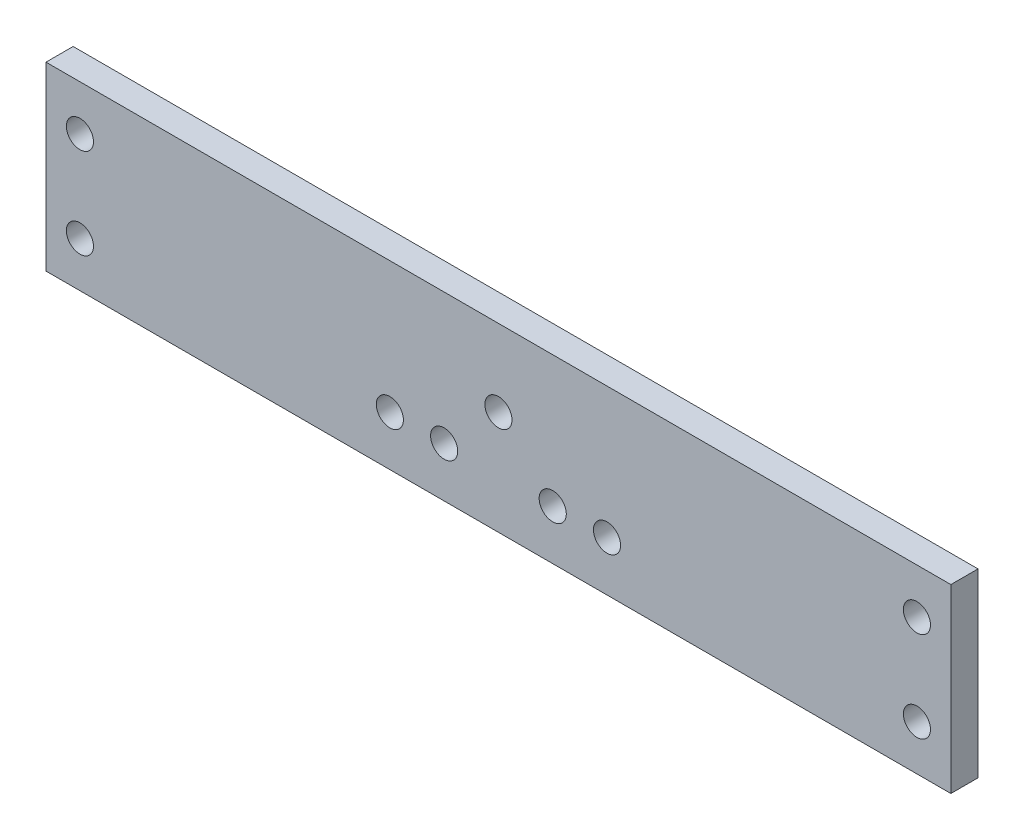
from build123d import *

# Parameters (mm, degrees)
SKETCH_1_R      = 1.5
EXTRUDE_1_DEPTH = 3


with BuildPart() as part:
    # 草圖1 → 填料-伸長1 (new body)
    with BuildSketch(Plane.XY):
        Polygon((50, 10), (0, 10), (-50, 10), (-50, -10), (0, -10), (50, -10), align=None)
        with Locations((-46.25, -5)):
            Circle(SKETCH_1_R, mode=Mode.SUBTRACT)
        with Locations((-12, -4.5)):
            Circle(SKETCH_1_R, mode=Mode.SUBTRACT)
        with BuildLine():
            ThreePointArc((-7.5, -4.5), (-6, -3), (-4.5, -4.5))
            ThreePointArc((-4.5, -4.5), (-6, -6), (-7.5, -4.5))
        make_face(mode=Mode.SUBTRACT)
        with BuildLine():
            ThreePointArc((7.5, -4.5), (6, -6), (4.5, -4.5))
            ThreePointArc((4.5, -4.5), (6, -3), (7.5, -4.5))
        make_face(mode=Mode.SUBTRACT)
        with BuildLine():
            ThreePointArc((13.5, -4.5), (12, -6), (10.5, -4.5))
            ThreePointArc((10.5, -4.5), (12, -3), (13.5, -4.5))
        make_face(mode=Mode.SUBTRACT)
        with Locations((46.25, -5)):
            Circle(SKETCH_1_R, mode=Mode.SUBTRACT)
        with Locations((-46.25, 5)):
            Circle(SKETCH_1_R, mode=Mode.SUBTRACT)
        with Locations((0, 1.5)):
            Circle(SKETCH_1_R, mode=Mode.SUBTRACT)
        with Locations((46.25, 5)):
            Circle(SKETCH_1_R, mode=Mode.SUBTRACT)
    extrude(amount=EXTRUDE_1_DEPTH)


solid = part.part
